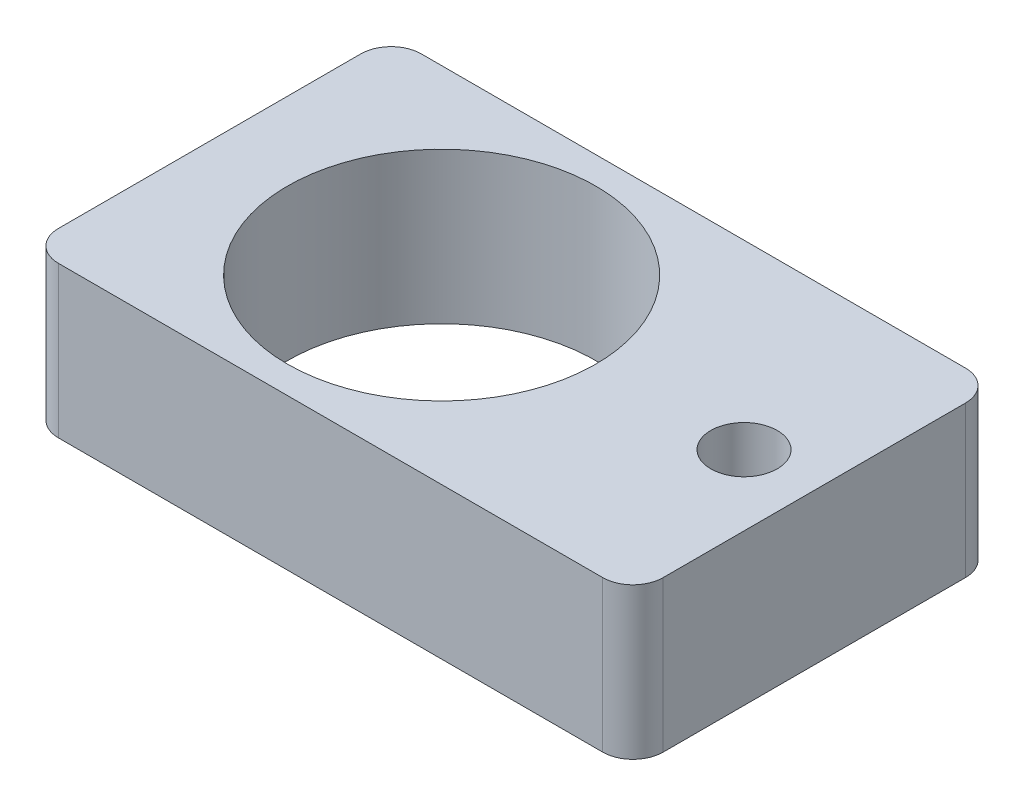
from build123d import *

# Parameters (mm, degrees)
SKETCH1_W           = 20
SKETCH1_H           = 12
SKETCH1_R           = 5.1
SKETCH1_R_2         = 1.1
BOSS_EXTRUDE1_DEPTH = 5
FILLET1_R           = 1


with BuildPart() as part:
    # Sketch1 → Boss-Extrude1 (new body)
    with BuildSketch(Plane(origin=(0, 0, 0), x_dir=(1, 0, 0), z_dir=(0, 1, 0))):
        Rectangle(SKETCH1_W, SKETCH1_H)
        with Locations(Location((-2.32697534, 0, 0), (0, 0, 270))):
            Circle(SKETCH1_R, mode=Mode.SUBTRACT)
        with Locations(Location((7.67302466, 0, 0), (0, 0, 270))):
            Circle(SKETCH1_R_2, mode=Mode.SUBTRACT)
    extrude(amount=BOSS_EXTRUDE1_DEPTH)

    # Fillet1
    fillet1_edges = [part.edges().sort_by_distance(p)[0] for p in [
        (-10, 2.5, -6),
        (10, 2.5, -6),
        (10, 2.5, 6),
        (-10, 2.5, 6),
    ]]
    fillet(fillet1_edges, radius=FILLET1_R)


solid = part.part
